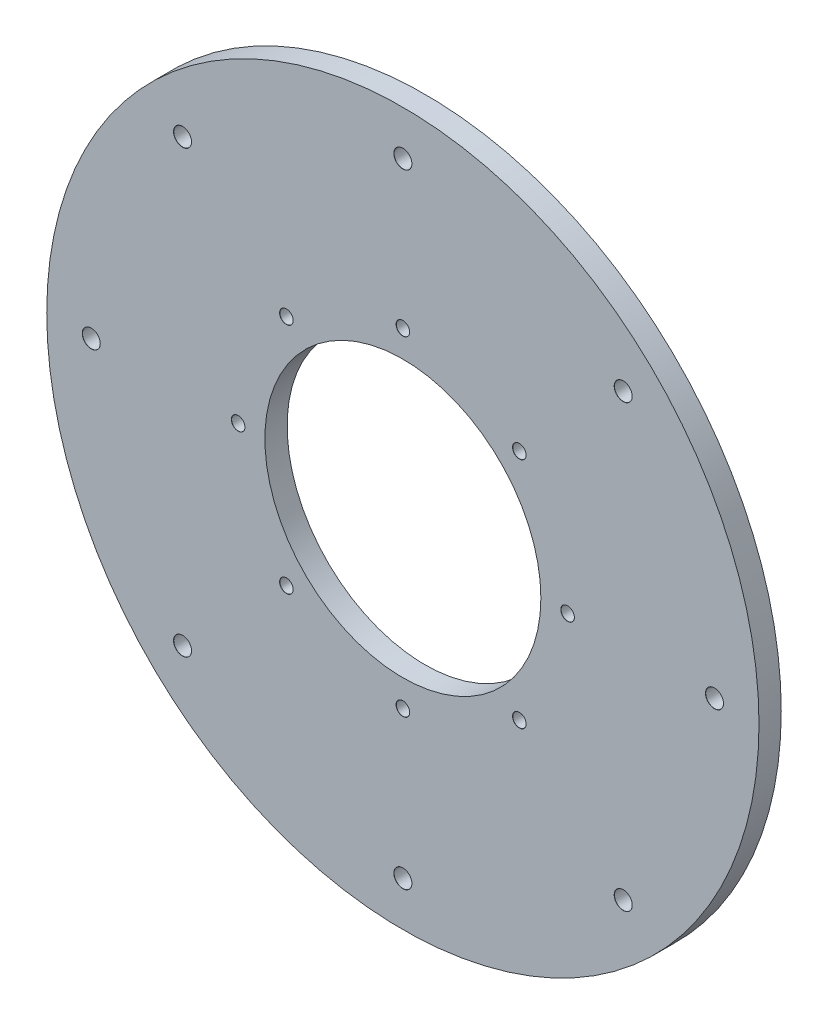
from build123d import *

# Parameters (mm, degrees)
SKETCH2_R                       = 80
SKETCH2_R_2                     = 31
BOSS_EXTRUDE1_DEPTH             = 5
F_4_0MM_DOWEL_HOLE1_D           = 4
F_4_0MM_DOWEL_HOLE1_CSINK_D     = 4.05
F_4_0MM_DOWEL_HOLE1_CSINK_ANGLE = 90
F_3_0MM_DOWEL_HOLE1_D           = 3
F_3_0MM_DOWEL_HOLE1_CSINK_D     = 3.05
F_3_0MM_DOWEL_HOLE1_CSINK_ANGLE = 90


with BuildPart() as part:
    # Sketch2 → Boss-Extrude1 (new body)
    with BuildSketch(Plane.XY):
        Circle(SKETCH2_R)
        Circle(SKETCH2_R_2, mode=Mode.SUBTRACT)
    extrude(amount=BOSS_EXTRUDE1_DEPTH)

    # Ø4.0mm Dowel Hole1 (through all)
    with Locations(Plane.XY.offset(5)):
        with Locations((0, 70), (-49.497474683, 49.497474683), (-70, 0), (-49.497474683, -49.497474683), (0, -70), (49.497474683, -49.497474683), (70, 0), (49.497474683, 49.497474683)):
            CounterSinkHole(F_4_0MM_DOWEL_HOLE1_D / 2, F_4_0MM_DOWEL_HOLE1_CSINK_D / 2, counter_sink_angle=F_4_0MM_DOWEL_HOLE1_CSINK_ANGLE)

    # Ø3.0mm Dowel Hole1 (through all)
    with Locations(Plane.XY.offset(5)):
        with Locations((0, 37), (-26.162950904, 26.162950904), (-37, 0), (-26.162950904, -26.162950904), (0, -37), (26.162950904, -26.162950904), (37, 0), (26.162950904, 26.162950904)):
            CounterSinkHole(F_3_0MM_DOWEL_HOLE1_D / 2, F_3_0MM_DOWEL_HOLE1_CSINK_D / 2, counter_sink_angle=F_3_0MM_DOWEL_HOLE1_CSINK_ANGLE)


solid = part.part
